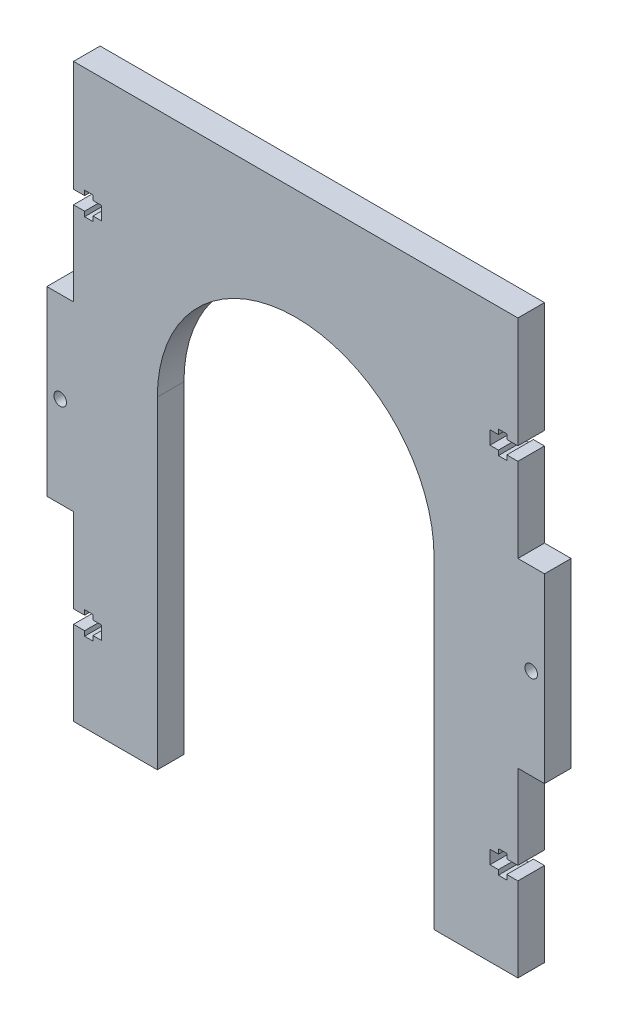
from build123d import *

# Parameters (mm, degrees)
SKETCH1_R           = 1.5
BOSS_EXTRUDE1_DEPTH = 6.35


with BuildPart() as part:
    # Sketch1 → Boss-Extrude1 (new body)
    with BuildSketch(Plane.XY):
        with BuildLine():
            Line((6.35, 6.35), (6.35, -20.066666667))
            Line((6.35, -20.066666667), (9, -20.066666667))
            Line((9, -20.066666667), (9, -18.916666667))
            Line((9, -18.916666667), (11, -18.916666667))
            Line((11, -18.916666667), (11, -20.066666667))
            Line((11, -20.066666667), (13, -20.066666667))
            Line((13, -20.066666667), (13, -23.266666667))
            Line((13, -23.266666667), (11, -23.266666667))
            Line((11, -23.266666667), (11, -24.416666667))
            Line((11, -24.416666667), (9, -24.416666667))
            Line((9, -24.416666667), (9, -23.266666667))
            Line((9, -23.266666667), (6.35, -23.266666667))
            Line((6.35, -23.266666667), (6.35, -43.333333333))
            Line((6.35, -43.333333333), (0, -43.333333333))
            Line((0, -43.333333333), (0, -86.666666667))
            Line((0, -86.666666667), (6.35, -86.666666667))
            Line((6.35, -86.666666667), (6.35, -106.733333333))
            Line((6.35, -106.733333333), (9, -106.733333333))
            Line((9, -106.733333333), (9, -105.583333333))
            Line((9, -105.583333333), (11, -105.583333333))
            Line((11, -105.583333333), (11, -106.733333333))
            Line((11, -106.733333333), (13, -106.733333333))
            Line((13, -106.733333333), (13, -109.933333333))
            Line((13, -109.933333333), (11, -109.933333333))
            Line((11, -109.933333333), (11, -111.083333333))
            Line((11, -111.083333333), (9, -111.083333333))
            Line((9, -111.083333333), (9, -109.933333333))
            Line((9, -109.933333333), (6.35, -109.933333333))
            Line((6.35, -109.933333333), (6.35, -130))
            Line((6.35, -130), (26.35, -130))
            Line((26.35, -130), (26.35, -53))
            ThreePointArc((26.35, -53), (59.35, -20), (92.35, -53))
            Line((92.35, -53), (92.35, -130))
            Line((92.35, -130), (112.35, -130))
            Line((112.35, -130), (112.35, -109.933333333))
            Line((112.35, -109.933333333), (109.7, -109.933333333))
            Line((109.7, -109.933333333), (109.7, -111.083333333))
            Line((109.7, -111.083333333), (107.7, -111.083333333))
            Line((107.7, -111.083333333), (107.7, -109.933333333))
            Line((107.7, -109.933333333), (105.7, -109.933333333))
            Line((105.7, -109.933333333), (105.7, -106.733333333))
            Line((105.7, -106.733333333), (107.7, -106.733333333))
            Line((107.7, -106.733333333), (107.7, -105.583333333))
            Line((107.7, -105.583333333), (109.7, -105.583333333))
            Line((109.7, -105.583333333), (109.7, -106.733333333))
            Line((109.7, -106.733333333), (112.35, -106.733333333))
            Line((112.35, -106.733333333), (112.35, -86.666666667))
            Line((112.35, -86.666666667), (118.7, -86.666666667))
            Line((118.7, -86.666666667), (118.7, -43.333333333))
            Line((118.7, -43.333333333), (112.35, -43.333333333))
            Line((112.35, -43.333333333), (112.35, -23.266666667))
            Line((112.35, -23.266666667), (109.7, -23.266666667))
            Line((109.7, -23.266666667), (109.7, -24.416666667))
            Line((109.7, -24.416666667), (107.7, -24.416666667))
            Line((107.7, -24.416666667), (107.7, -23.266666667))
            Line((107.7, -23.266666667), (105.7, -23.266666667))
            Line((105.7, -23.266666667), (105.7, -20.066666667))
            Line((105.7, -20.066666667), (107.7, -20.066666667))
            Line((107.7, -20.066666667), (107.7, -18.916666667))
            Line((107.7, -18.916666667), (109.7, -18.916666667))
            Line((109.7, -18.916666667), (109.7, -20.066666667))
            Line((109.7, -20.066666667), (112.35, -20.066666667))
            Line((112.35, -20.066666667), (112.35, 6.35))
            Line((112.35, 6.35), (6.35, 6.35))
        make_face()
        with Locations((3.175, -65)):
            Circle(SKETCH1_R, mode=Mode.SUBTRACT)
        with Locations((115.525, -65)):
            Circle(SKETCH1_R, mode=Mode.SUBTRACT)
    extrude(amount=BOSS_EXTRUDE1_DEPTH)


solid = part.part
